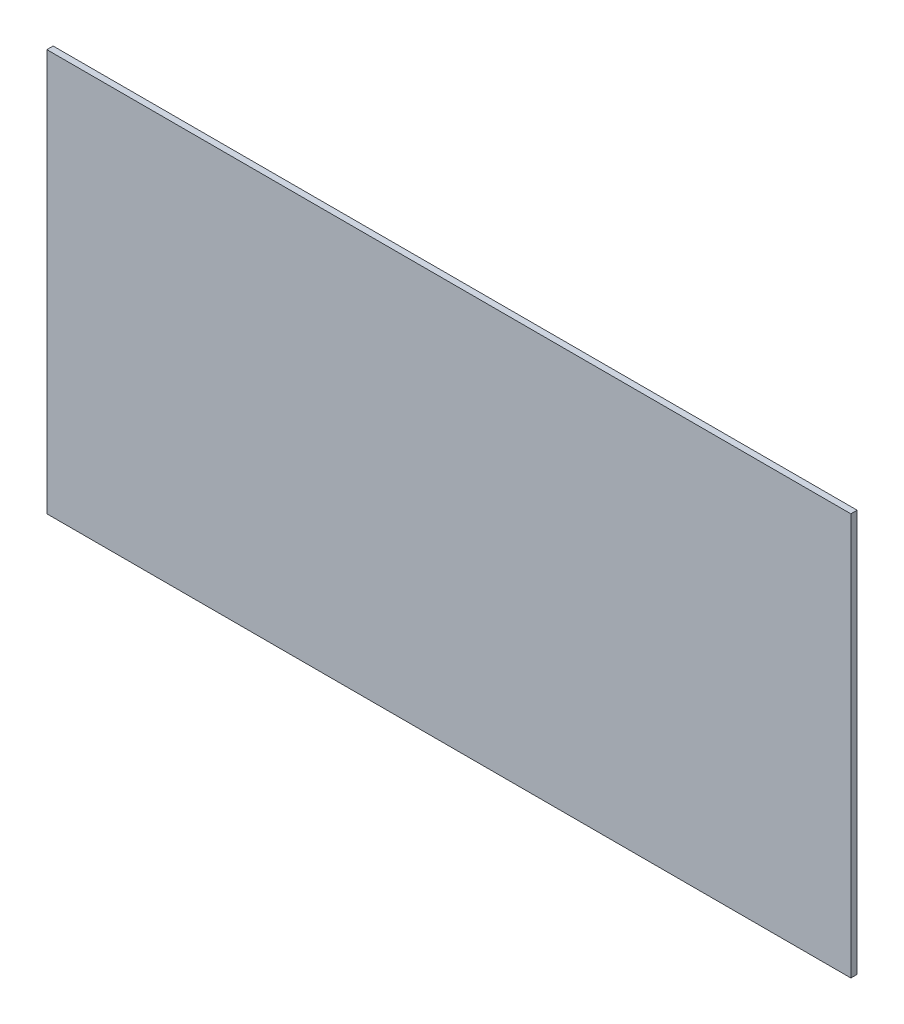
from build123d import *

# Parameters (mm, degrees)
SKETCH3_W           = 609.6
SKETCH3_H           = 304.8
BOSS_EXTRUDE1_DEPTH = 2.38125


with BuildPart() as part:
    # Sketch3 → Boss-Extrude1 (new, symmetric)
    with BuildSketch(Plane.XY):
        Rectangle(SKETCH3_W, SKETCH3_H)
    extrude(amount=BOSS_EXTRUDE1_DEPTH, both=True)


solid = part.part
